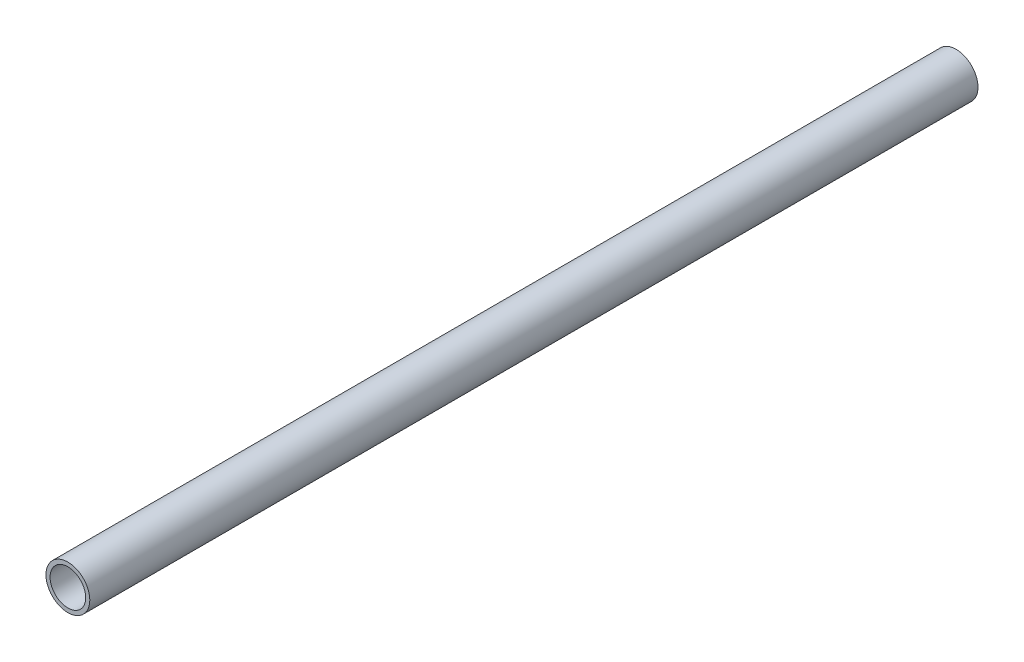
from build123d import *

# Parameters (mm, degrees)
SKETCH1_R           = 4.7625
SKETCH1_R_2         = 3.8735
BOSS_EXTRUDE1_DEPTH = 193


with BuildPart() as part:
    # Sketch1 → Boss-Extrude1 (new body)
    with BuildSketch(Plane.XY):
        Circle(SKETCH1_R)
        Circle(SKETCH1_R_2, mode=Mode.SUBTRACT)
    extrude(amount=BOSS_EXTRUDE1_DEPTH)


solid = part.part
